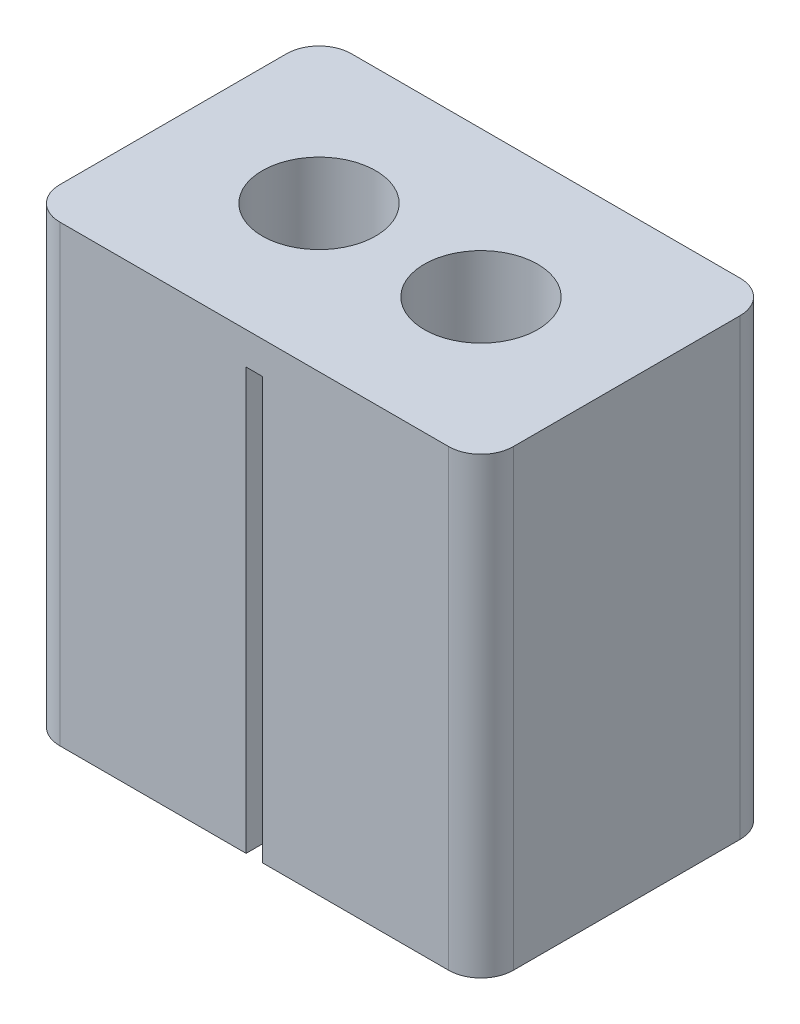
from build123d import *

# Parameters (mm, degrees)
SKETCH_1_W          = 14
SKETCH_1_H          = 9
EXTRUDE_1_DEPTH     = 14
FILLET_1_R          = 1
SKETCH_3_R          = 1.75
CUT_EXTRUDE_2_DEPTH = 7
CUT_EXTRUDE_3_REACH = 12.874
SKETCH_4_R          = 1.05
CUT_EXTRUDE_START   = -14
SKETCH_6_W          = 0.5
SKETCH_6_H          = 9
CUT_EXTRUDE_4_DEPTH = 13


with BuildPart() as part:
    # 草图1 → 凸台-拉伸1 (new body)
    with BuildSketch(Plane(origin=(0, 0, 0), x_dir=(1, 0, 0), z_dir=(0, 1, 0))):
        Rectangle(SKETCH_1_W, SKETCH_1_H)
    extrude(amount=EXTRUDE_1_DEPTH)

    # 圆角1
    fillet_1_edges = [part.edges().sort_by_distance(p)[0] for p in [
        (7, 7, 4.5),
        (-7, 7, 4.5),
        (-7, 7, -4.5),
        (7, 7, -4.5),
    ]]
    fillet(fillet_1_edges, radius=FILLET_1_R)

    # 草图3 → 切除-拉伸2 (cut)
    with BuildSketch(Plane(origin=(0, 14, 0), x_dir=(1, 0, 0), z_dir=(0, 1, 0))):
        with Locations(Location((-2.5, 0, 0), (0, 0, 270))):
            Circle(SKETCH_3_R)
        with Locations(Location((2.5, 0, 0), (0, 0, 90))):
            Circle(SKETCH_3_R)
    extrude(amount=-CUT_EXTRUDE_2_DEPTH, mode=Mode.SUBTRACT)

    # 草图4 → 切除-拉伸3 (cut, up to next)
    with BuildSketch(Plane(origin=(0, 7, 0), x_dir=(1, 0, 0), z_dir=(0, 1, 0)), mode=Mode.PRIVATE) as cut_extrude_3_sk1:
        with Locations(Location((-2.5, 0, 0), (0, 0, 270))):
            Circle(SKETCH_4_R)
    cut_extrude_3_tool1 = extrude(cut_extrude_3_sk1.sketch, amount=-CUT_EXTRUDE_3_REACH, mode=Mode.PRIVATE) & part.part
    # 草图4 → 切除-拉伸3 (cut, up to next)
    with BuildSketch(Plane(origin=(0, 7, 0), x_dir=(1, 0, 0), z_dir=(0, 1, 0)), mode=Mode.PRIVATE) as cut_extrude_3_sk2:
        with Locations(Location((2.5, 0, 0), (0, 0, 270))):
            Circle(SKETCH_4_R)
    cut_extrude_3_tool2 = extrude(cut_extrude_3_sk2.sketch, amount=-CUT_EXTRUDE_3_REACH, mode=Mode.PRIVATE) & part.part
    add(cut_extrude_3_tool1.solids().sort_by_distance((-2.5, 7, 0))[0], mode=Mode.SUBTRACT)
    add(cut_extrude_3_tool2.solids().sort_by_distance((2.5, 7, 0))[0], mode=Mode.SUBTRACT)

    # 草图6 → 切除-拉伸4 (cut)
    with BuildSketch(Plane(origin=(0, 14, 0), x_dir=(1, 0, 0), z_dir=(0, 1, 0)).offset(CUT_EXTRUDE_START)):
        Rectangle(SKETCH_6_W, SKETCH_6_H)
    extrude(amount=CUT_EXTRUDE_4_DEPTH, mode=Mode.SUBTRACT)


solid = part.part
